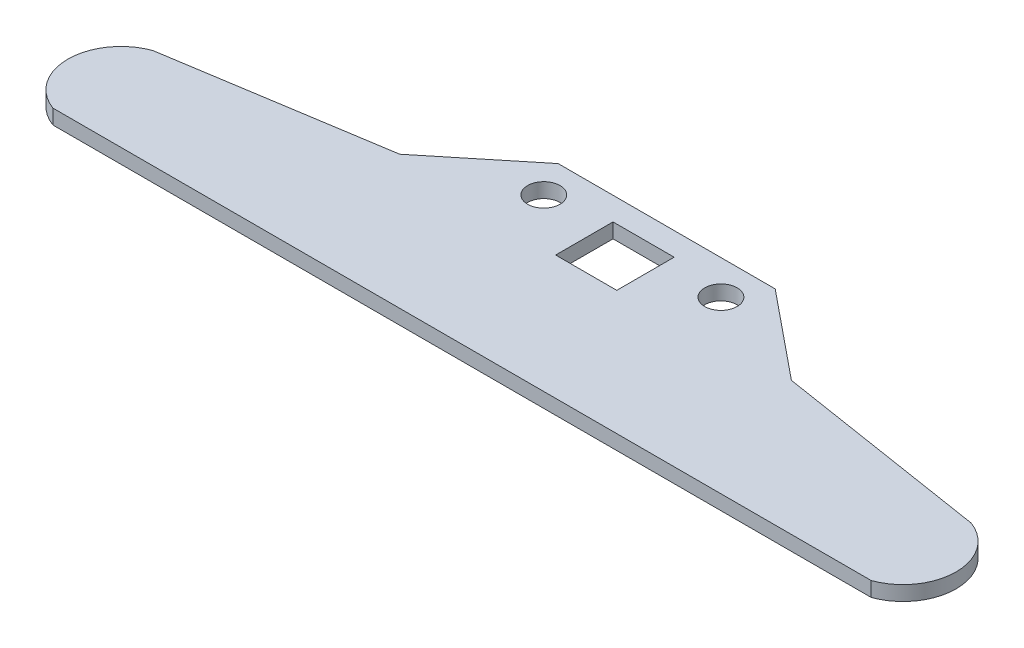
from build123d import *

# Parameters (mm, degrees)
SKETCH1_R           = 2.805320717
SKETCH1_W           = 10.573901166
SKETCH1_H           = 9.926519461
BOSS_EXTRUDE1_DEPTH = 2.54


with BuildPart() as part:
    # Sketch1 → Boss-Extrude1 (new body)
    with BuildSketch(Plane(origin=(0, 0, 0), x_dir=(1, 0, 0), z_dir=(0, 1, 0))):
        with BuildLine():
            Line((70.780399637, 0), (-70.780399637, 0))
            ThreePointArc((-70.780399637, 0), (-76.832778265, 8.631756053), (-70.780399637, 17.263512107))
            Line((-70.780399637, 17.263512107), (-33.879642509, 23.089947443))
            Line((-33.879642509, 23.089947443), (-18.774069416, 35.390199818))
            Line((-18.774069416, 35.390199818), (18.774069416, 35.390199818))
            Line((18.774069416, 35.390199818), (33.879642509, 23.089947443))
            Line((33.879642509, 23.089947443), (70.780399637, 17.263512107))
            ThreePointArc((70.780399637, 17.263512107), (76.832778265, 8.631756053), (70.780399637, 0))
        make_face()
        with Locations(Location((-15.321366995, 29.455867532, 0), (0, 0, 270))):
            Circle(SKETCH1_R, mode=Mode.SUBTRACT)
        with Locations(Location((15.321366995, 29.455867532, 0), (0, 0, 90))):
            Circle(SKETCH1_R, mode=Mode.SUBTRACT)
        with Locations((0, 26.434752913)):
            Rectangle(SKETCH1_W, SKETCH1_H, mode=Mode.SUBTRACT)
    extrude(amount=BOSS_EXTRUDE1_DEPTH)


solid = part.part
